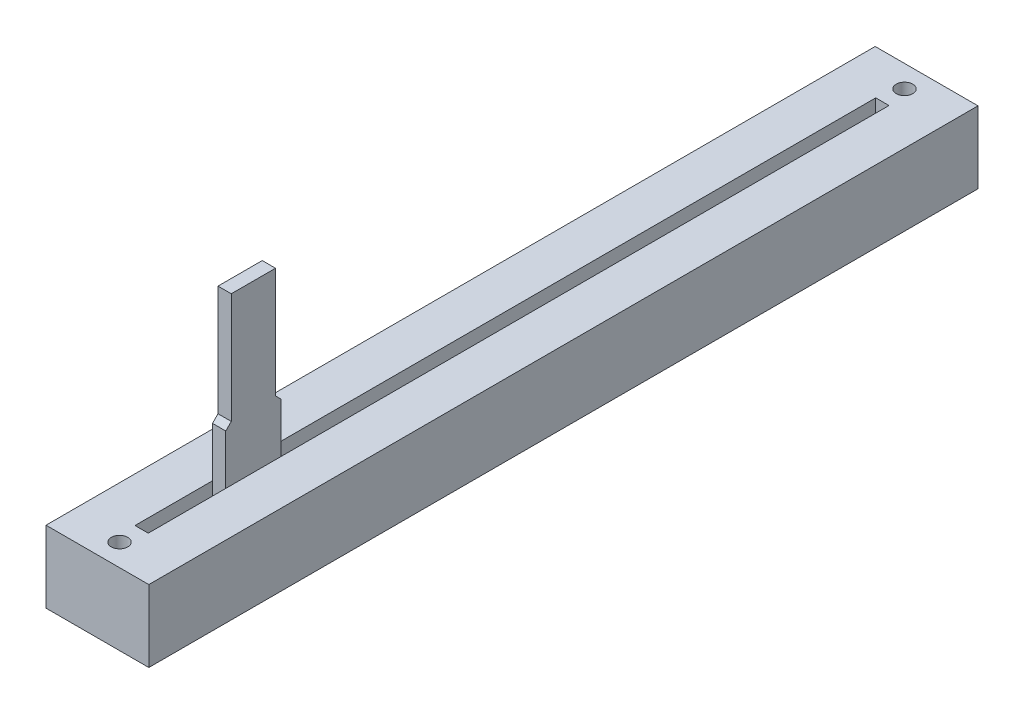
from build123d import *

# Parameters (mm, degrees)
ESQUISSE1_W             = 9.3
ESQUISSE1_H             = 75
BOSS_EXTRU_1_DEPTH      = 6.5
ESQUISSE2_R             = 0.75
ENL_V_MAT_EXTRU_1_DEPTH = 4
ESQUISSE3_W             = 1.2
ESQUISSE3_H             = 67
ENL_V_MAT_EXTRU_2_DEPTH = 4
BOSS_EXTRU_2_DEPTH      = 0.6


with BuildPart() as part:
    # Esquisse1 → Boss.-Extru.1 (new body)
    with BuildSketch(Plane(origin=(0, 0, 0), x_dir=(1, 0, 0), z_dir=(0, 1, 0))):
        Rectangle(ESQUISSE1_W, ESQUISSE1_H)
    extrude(amount=BOSS_EXTRU_1_DEPTH)

    # Esquisse2 → Enlèv. mat.-Extru.1 (cut)
    with BuildSketch(Plane(origin=(0, 6.5, 0), x_dir=(1, 0, 0), z_dir=(0, 1, 0))):
        with Locations(Location((0, 35.5, 0), (0, 0, 270))):
            Circle(ESQUISSE2_R)
        with Locations(Location((0, -35.5, 0), (0, 0, 270))):
            Circle(ESQUISSE2_R)
    extrude(amount=-ENL_V_MAT_EXTRU_1_DEPTH, mode=Mode.SUBTRACT)

    # Esquisse3 → Enlèv. mat.-Extru.2 (cut)
    with BuildSketch(Plane(origin=(0, 6.5, 0), x_dir=(1, 0, 0), z_dir=(0, 1, 0))):
        Rectangle(ESQUISSE3_W, ESQUISSE3_H)
    extrude(amount=-ENL_V_MAT_EXTRU_2_DEPTH, mode=Mode.SUBTRACT)

    # Esquisse4 → Boss.-Extru.2 (add, symmetric)
    with BuildSketch(Plane(origin=(0, 0, 0), x_dir=(0, 0, -1), z_dir=(1, 0, 0))):
        Polygon((-26.491586963, 2.5), (-21.491586963, 2.5), (-21.491586963, 11), (-21.991586963, 11.5), (-21.991586963, 21.5), (-25.991586963, 21.5), (-25.991586963, 11.5), (-26.491586963, 11), align=None)
    extrude(amount=BOSS_EXTRU_2_DEPTH, both=True)


solid = part.part
